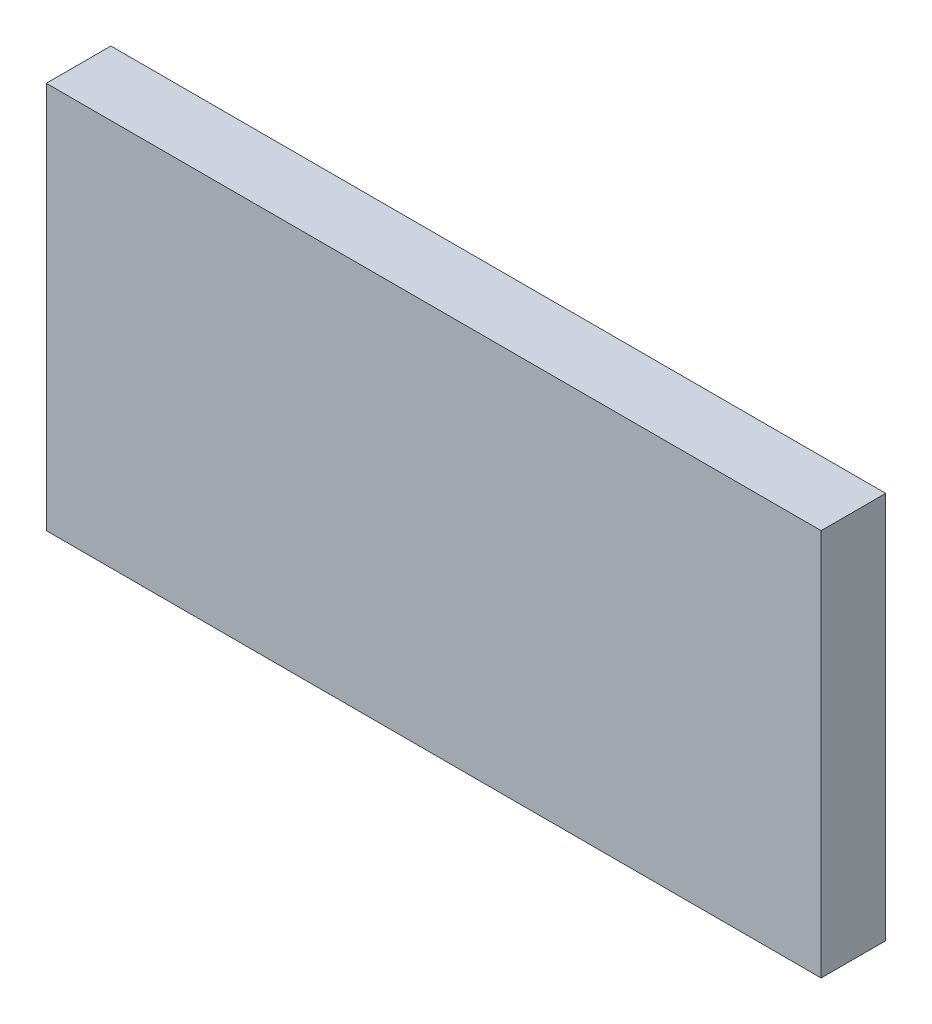
from build123d import *

# Parameters (mm, degrees)
SKETCH1_W           = 76.2
SKETCH1_H           = 38.1
BOSS_EXTRUDE1_DEPTH = 6.35


with BuildPart() as part:
    # Sketch1 → Boss-Extrude1 (new body)
    with BuildSketch(Plane.XY):
        Rectangle(SKETCH1_W, SKETCH1_H)
    extrude(amount=BOSS_EXTRUDE1_DEPTH)


solid = part.part
